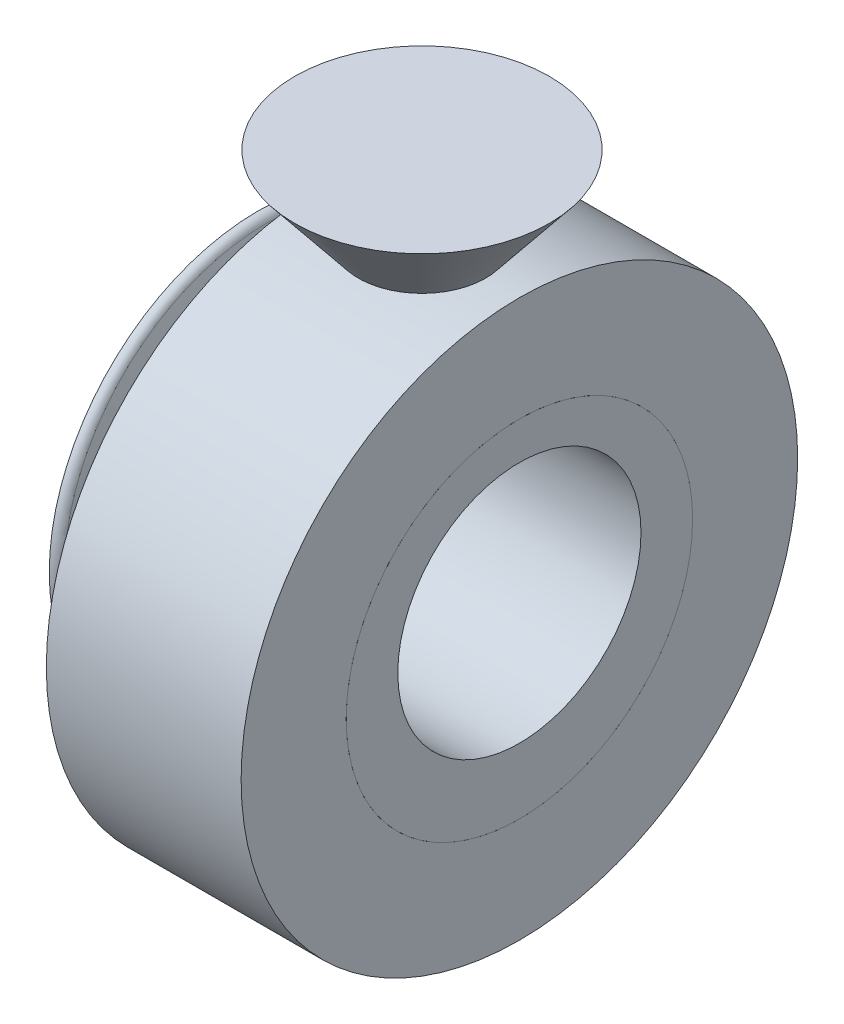
from build123d import *

# Parameters (mm, degrees)
SKETCH2_R           = 15.8115
SKETCH2_R_2         = 11.1
BOSS_EXTRUDE1_DEPTH = 17.78
SKETCH4_R           = 4.826
CUT_EXTRUDE1_DEPTH  = 17.78
SKETCH5_R           = 25.4
SKETCH5_R_2         = 15.8115
BOSS_EXTRUDE2_DEPTH = 17.78


with BuildPart() as part:
    # Sketch2 → Boss-Extrude1 (new body)
    with BuildSketch(Plane(origin=(0, 0, 0), x_dir=(0, 0, -1), z_dir=(1, 0, 0))):
        Circle(SKETCH2_R)
        with Locations((0, 1.27)):
            Circle(SKETCH2_R_2, mode=Mode.SUBTRACT)
    extrude(amount=BOSS_EXTRUDE1_DEPTH)

    # Sketch3 → Revolve1 (revolve)
    with BuildSketch(Plane.XY):
        with BuildLine():
            Line((0, 10.27), (0, 20.32))
            ThreePointArc((0, 20.32), (-0.338094609, 20.24504623), (-0.612835554, 20.034230088))
            Line((-0.612835554, 20.034230088), (-3.309894836, 16.82))
            ThreePointArc((-3.309894836, 16.82), (-4.046757878, 16.569868702), (-4.608872538, 17.107976423))
            Line((-4.608872538, 17.107976423), (-5.31065259, 19.727055236))
            ThreePointArc((-5.31065259, 19.727055236), (-5.596384108, 20.154682672), (-6.083393251, 20.32))
            Line((-6.083393251, 20.32), (-6.083393251, 10.27))
            Line((-6.083393251, 10.27), (0, 10.27))
        make_face()
    revolve(axis=Axis((8.89, 1.27, 0), (-1, 0, 0)))

    # Sketch4 → Cut-Extrude1 (cut)
    with BuildSketch(Plane(origin=(0, 0, 0), x_dir=(1, 0, 0), z_dir=(0, 1, 0))):
        with Locations(Location((8.89, 0, 0), (0, 0, 90))):
            Circle(SKETCH4_R)
    extrude(amount=CUT_EXTRUDE1_DEPTH, mode=Mode.SUBTRACT)


with BuildPart() as body_2:
    # Sketch5 → Boss-Extrude2 (new body)
    with BuildSketch(Plane(origin=(0, 0, 0), x_dir=(0, 0, -1), z_dir=(1, 0, 0))):
        Circle(SKETCH5_R)
        Circle(SKETCH5_R_2, mode=Mode.SUBTRACT)
    extrude(amount=BOSS_EXTRUDE2_DEPTH)


with BuildPart() as body_3:
    # Sketch6 → Revolve2 (revolve)
    with BuildSketch(Plane.XY, mode=Mode.PRIVATE) as revolve2_sk:
        Polygon((8.89, 25.4), (8.89, 32.639), (20.515876198, 32.639), (14.702938099, 25.4), align=None)
    revolve(revolve2_sk.sketch.rotate(Axis((8.89, 25.4, 0), (0, 1, 0)), 90), axis=Axis((8.89, 25.4, 0), (0, 1, 0)))


solid = Compound([part.part, body_2.part, body_3.part])
